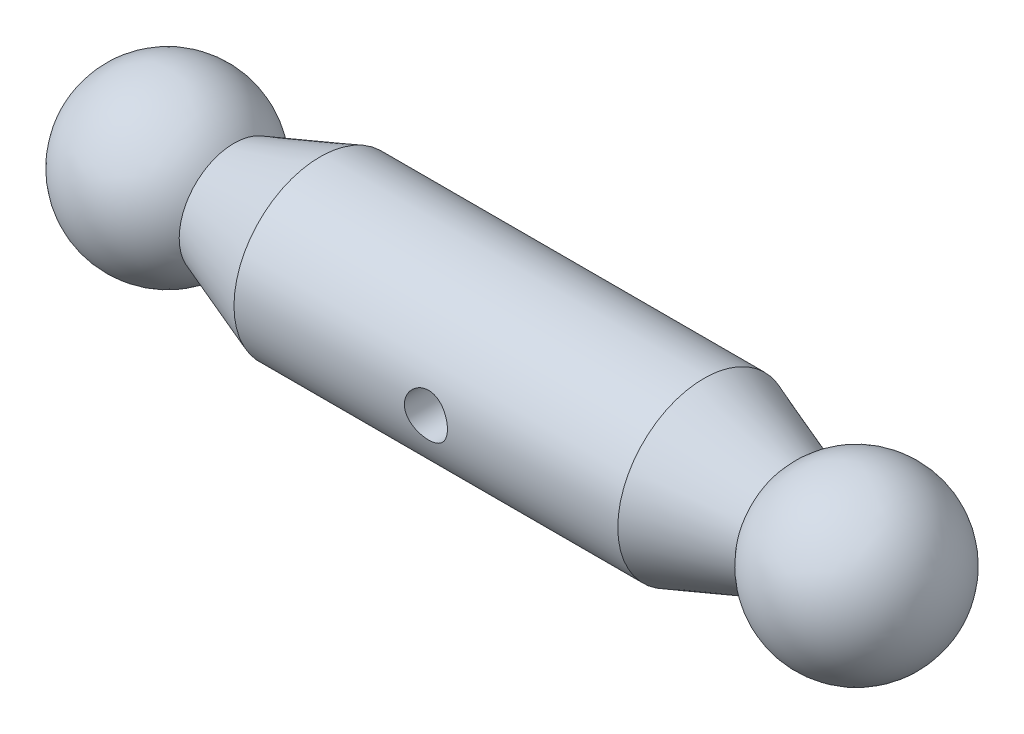
from build123d import *

# Parameters (mm, degrees)
ESQUISSE2_R             = 2
ENL_V_MAT_EXTRU_1_DEPTH = 20


with BuildPart() as part:
    # Esquisse1 → Base-Révolution (revolve)
    with BuildSketch(Plane.XY):
        with BuildLine():
            Line((-25.826683811, 5.088238126), (-17.826683811, 8))
            Line((-17.826683811, 8), (17.826683811, 8))
            Line((17.826683811, 8), (25.826683811, 5.088238126))
            ThreePointArc((25.826683811, 5.088238126), (34.703097342, 7.529492995), (40, 0))
            Line((40, 0), (-40, 0))
            ThreePointArc((-40, 0), (-34.703097342, 7.529492995), (-25.826683811, 5.088238126))
        make_face()
    revolve(axis=Axis((-66.129346734, 0, 0), (1, 0, 0)))

    # Esquisse2 → Enlèv. mat.-Extru.1 (cut, symmetric)
    with BuildSketch(Plane.XY):
        Circle(ESQUISSE2_R)
    extrude(amount=ENL_V_MAT_EXTRU_1_DEPTH, both=True, mode=Mode.SUBTRACT)


solid = part.part
